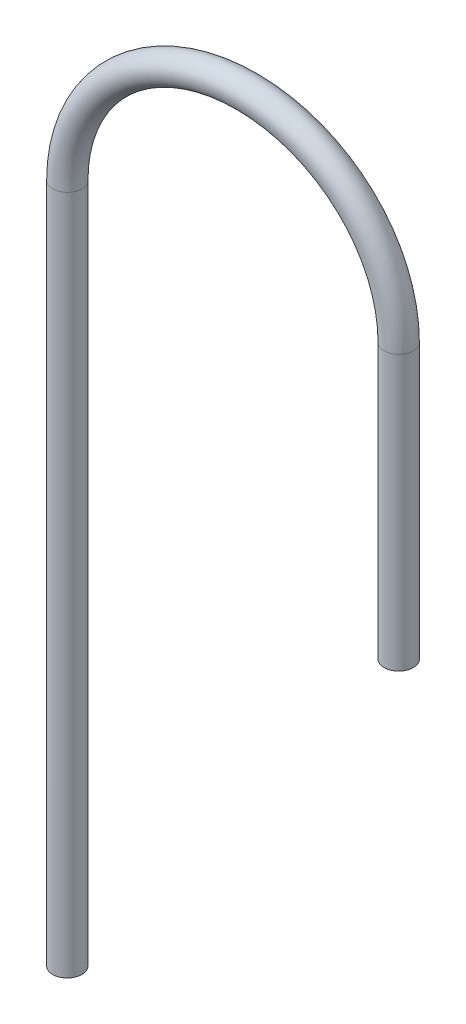
from build123d import *

# Parameters (mm, degrees)
BALAYAGE_MINCE1_PROFILE_R   = 3
BALAYAGE_MINCE1_PROFILE_R_2 = 2


with BuildPart() as part:
    # Balayage-Mince1: sweep along a curve in space
    with BuildLine() as balayage_mince1_path:
        Line((-14, 165, -59.25), (-14, 221.325, -59.25))
        ThreePointArc((-14, 221.325, -59.25), (-45.407462351, 252.840799577, -56.639074556), (-76.814924701, 221.325, -54.028149113))
        Line((-76.814924701, 221.325, -54.028149113), (-76.814924701, 81.65, -54.028149113))
    # Balayage-Mince1 profile (on start of the path) → Balayage-Mince1 (sweep)
    with BuildSketch(Plane(origin=(-14, 165, -59.25), x_dir=(0, 0, 1), z_dir=(0, 1, 0))):
        Circle(BALAYAGE_MINCE1_PROFILE_R)
        Circle(BALAYAGE_MINCE1_PROFILE_R_2, mode=Mode.SUBTRACT)
    sweep(path=balayage_mince1_path.line)


solid = part.part
